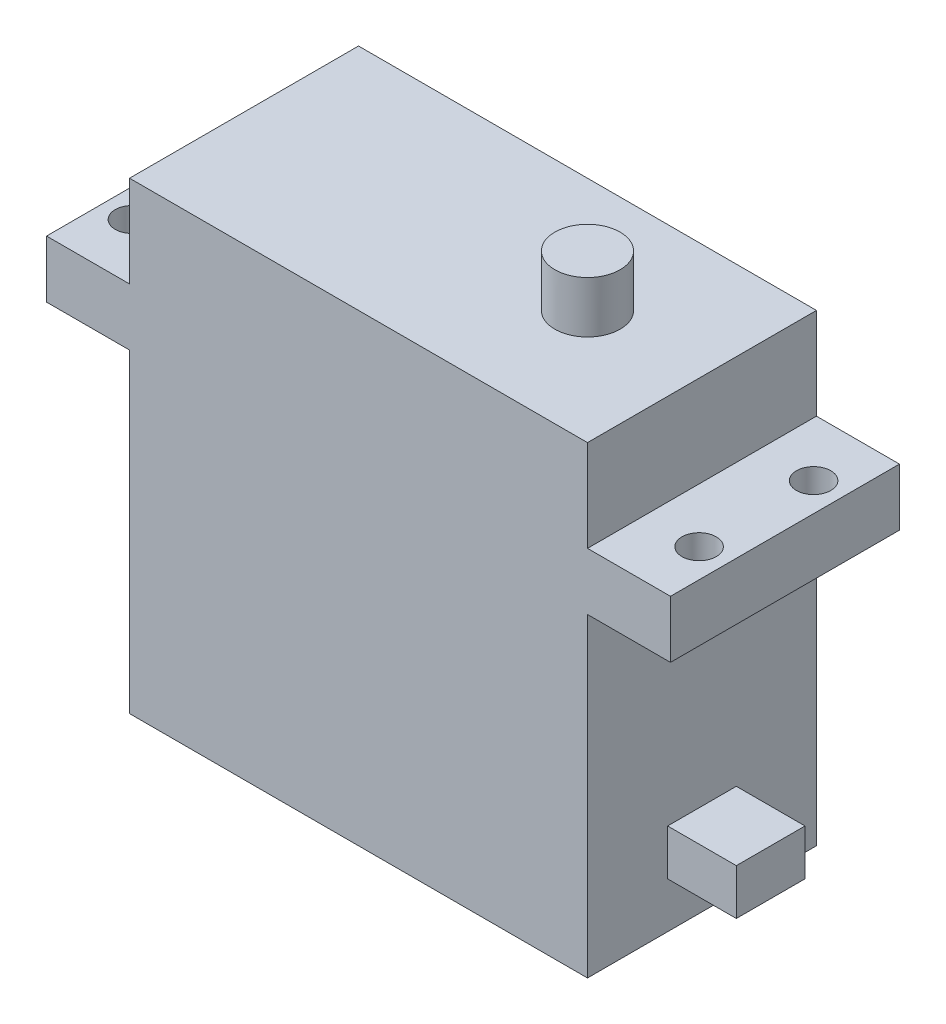
from build123d import *

# Parameters (mm, degrees)
SKETCH1_W           = 40
SKETCH1_H           = 8
SKETCH1_W_2         = 7.25
SKETCH1_H_2         = 5
SKETCH1_H_3         = 27.5
BOSS_EXTRUDE1_DEPTH = 20
SKETCH2_R           = 2.85
BOSS_EXTRUDE2_DEPTH = 4.5
SKETCH3_R           = 1.5
CUT_EXTRUDE1_DEPTH  = 47.891497097
SKETCH4_W           = 6
SKETCH4_H           = 4
BOSS_EXTRUDE3_DEPTH = 6


with BuildPart() as part:
    # Sketch1 → Boss-Extrude1 (new body)
    with BuildSketch(Plane.XY):
        with Locations((0, -4)):
            Rectangle(SKETCH1_W, SKETCH1_H)
        with Locations((-23.625, -10.5)):
            Rectangle(SKETCH1_W_2, SKETCH1_H_2)
        with Locations((0, -10.5)):
            Rectangle(SKETCH1_W, SKETCH1_H_2)
        with Locations((23.625, -10.5)):
            Rectangle(SKETCH1_W_2, SKETCH1_H_2)
        with Locations((0, -26.75)):
            Rectangle(SKETCH1_W, SKETCH1_H_3)
    extrude(amount=BOSS_EXTRUDE1_DEPTH)

    # Sketch2 → Boss-Extrude2 (add)
    with BuildSketch(Plane(origin=(0, 0, 0), x_dir=(1, 0, 0), z_dir=(0, 1, 0))):
        with Locations(Location((10, -10, 0), (0, 0, 90))):
            Circle(SKETCH2_R)
    extrude(amount=BOSS_EXTRUDE2_DEPTH)

    # Sketch3 → Cut-Extrude1 (cut, through all)
    with BuildSketch(Plane(origin=(0, -8, 0), x_dir=(1, 0, 0), z_dir=(0, 1, 0))):
        with Locations(Location((-24.75, -5, 0), (0, 0, 180))):
            Circle(SKETCH3_R)
        with Locations(Location((-24.75, -15, 0), (0, 0, 180))):
            Circle(SKETCH3_R)
        with Locations(Location((24.75, -15, 0), (0, 0, 180))):
            Circle(SKETCH3_R)
        with Locations(Location((24.75, -5, 0), (0, 0, 180))):
            Circle(SKETCH3_R)
    extrude(amount=-CUT_EXTRUDE1_DEPTH, mode=Mode.SUBTRACT)

    # Sketch4 → Boss-Extrude3 (add)
    with BuildSketch(Plane(origin=(20, 0, 0), x_dir=(0, 0, -1), z_dir=(1, 0, 0))):
        with Locations((-10, -34.5)):
            Rectangle(SKETCH4_W, SKETCH4_H)
    extrude(amount=BOSS_EXTRUDE3_DEPTH)


solid = part.part
